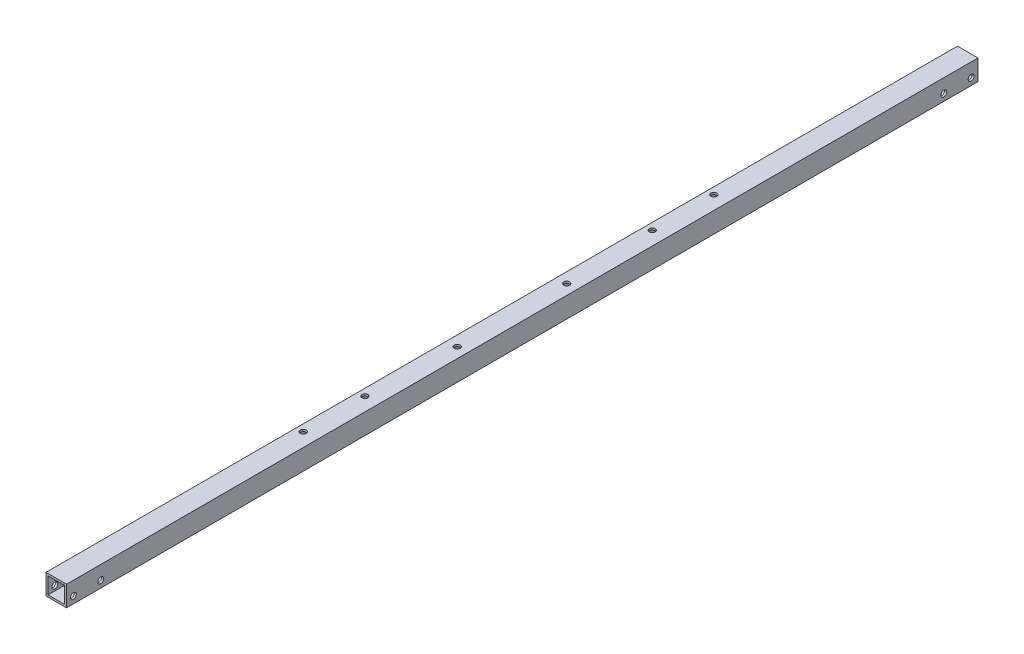
from build123d import *

# Parameters (mm, degrees)
SKETCH_1_W          = 15
SKETCH_1_H          = 15
SKETCH_1_W_2        = 12
SKETCH_1_H_2        = 12
EXTRUDE_1_DEPTH     = 666
SKETCH_2_R          = 2.15
CUT_EXTRUDE_1_DEPTH = 667.211115188
SKETCH_3_R          = 2.15
CUT_EXTRUDE_2_DEPTH = 667.211115188


with BuildPart() as part:
    # ｽｹｯﾁ1 → 押し出し-薄板1 (new body)
    with BuildSketch(Plane.XY):
        Rectangle(SKETCH_1_W, SKETCH_1_H)
        Rectangle(SKETCH_1_W_2, SKETCH_1_H_2, mode=Mode.SUBTRACT)
    extrude(amount=EXTRUDE_1_DEPTH)

    # ｽｹｯﾁ2 → ｶｯﾄ - 押し出し1 (cut, through all)
    with BuildSketch(Plane(origin=(7.5, 0, 0), x_dir=(0, 0, -1), z_dir=(1, 0, 0))):
        with Locations(Location((-5, -2.5, 0), (0, 0, 90))):
            Circle(SKETCH_2_R)
        with Locations(Location((-661, -2.5, 0), (0, 0, 90))):
            Circle(SKETCH_2_R)
        with Locations(Location((-25, -2.5, 0), (0, 0, 90))):
            Circle(SKETCH_2_R)
        with Locations(Location((-641, -2.5, 0), (0, 0, 90))):
            Circle(SKETCH_2_R)
    extrude(amount=-CUT_EXTRUDE_1_DEPTH, mode=Mode.SUBTRACT)

    # ｽｹｯﾁ3 → ｶｯﾄ - 押し出し2 (cut, through all)
    with BuildSketch(Plane(origin=(0, 7.5, 0), x_dir=(1, 0, 0), z_dir=(0, 1, 0))):
        with Locations(Location((-2.5, -228, 0), (0, 0, 270))):
            Circle(SKETCH_3_R)
        with Locations(Location((-2.5, -438, 0), (0, 0, 270))):
            Circle(SKETCH_3_R)
        with Locations(Location((-2.5, -183, 0), (0, 0, 270))):
            Circle(SKETCH_3_R)
        with Locations(Location((-2.5, -483, 0), (0, 0, 270))):
            Circle(SKETCH_3_R)
        with Locations(Location((0, -373, 0), (0, 0, 270))):
            Circle(SKETCH_3_R)
        with Locations(Location((0, -293, 0), (0, 0, 270))):
            Circle(SKETCH_3_R)
    extrude(amount=-CUT_EXTRUDE_2_DEPTH, mode=Mode.SUBTRACT)


solid = part.part
